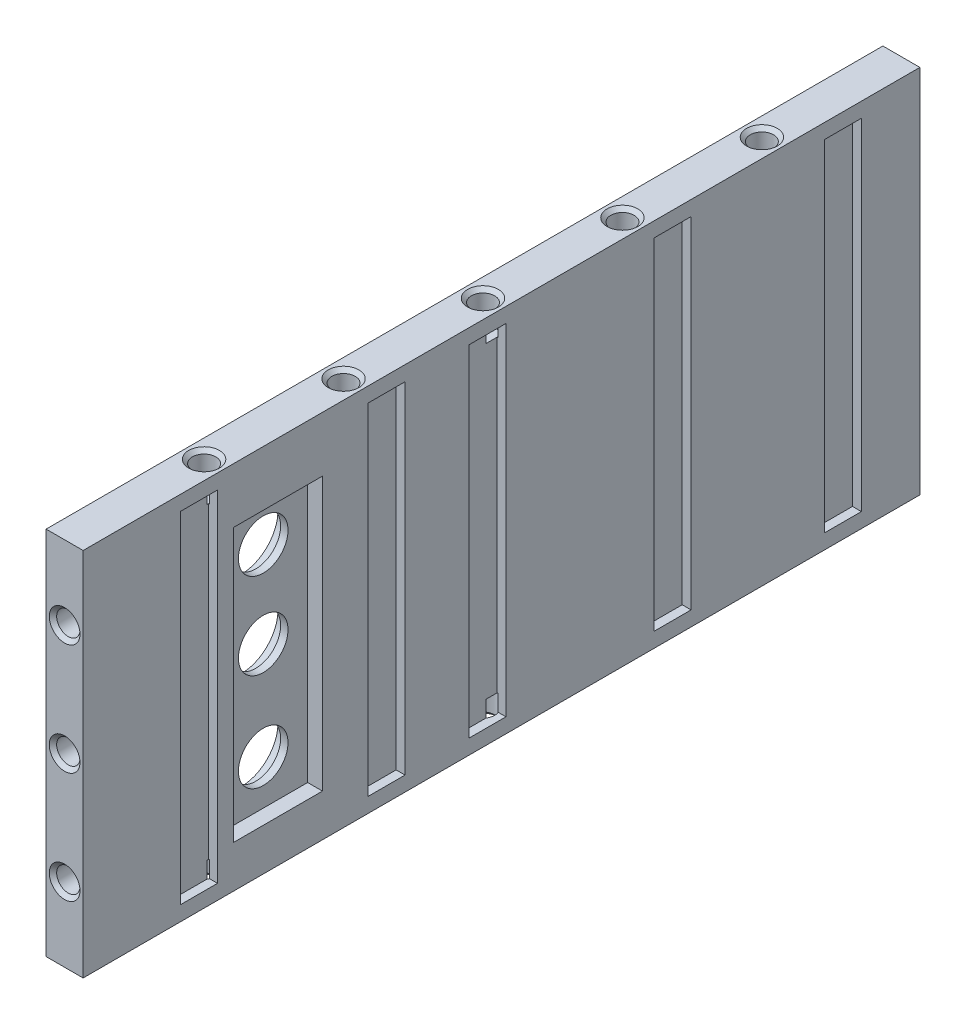
from build123d import *

# Parameters (mm, degrees)
SKETCH_1_W             = 113
SKETCH_1_H             = 50
EXTRUDE_1_DEPTH        = 5
SKETCH_2_R             = 1.575
CUT_EXTRUDE_610_DEPTH  = 4.2
SKETCH_3_R             = 1.575
CUT_EXTRUDE_919_DEPTH  = 4.2
SKETCH_4_W             = 5
SKETCH_4_H             = 46
CUT_EXTRUDE_1430_DEPTH = 1.2
SKETCH_5_R             = 3.35
SMA_DEPTH              = 116.840407458
SKETCH_6_R             = 5
SMA_2_DEPTH            = 2
SKETCH_7_W             = 12
SKETCH_7_H             = 36.84
SMA_3_DEPTH            = 2
CHAMFER_2760_SIZE      = 0.5


with BuildPart() as part:
    # Эскиз1 → Бобышка-Вытянуть1 (new body)
    with BuildSketch(Plane(origin=(0, 0, 0), x_dir=(0, 0, -1), z_dir=(1, 0, 0))):
        with Locations((-56.5, 0)):
            Rectangle(SKETCH_1_W, SKETCH_1_H)
    extrude(amount=EXTRUDE_1_DEPTH)

    # Эскиз2 → Cut-Extrude 610 (cut)
    with BuildSketch(Plane.XZ.offset(25)):
        with Locations(Location((2.5, 94.166666667, 0), (0, 0, 270))):
            Circle(SKETCH_2_R)
        with Locations(Location((2.5, 75.333333333, 0), (0, 0, 270))):
            Circle(SKETCH_2_R)
        with Locations(Location((2.5, 56.5, 0), (0, 0, 270))):
            Circle(SKETCH_2_R)
        with Locations(Location((2.5, 37.666666667, 0), (0, 0, 270))):
            Circle(SKETCH_2_R)
        with Locations(Location((2.5, 18.833333333, 0), (0, 0, 270))):
            Circle(SKETCH_2_R)
    cut_extrude_610 = extrude(amount=-CUT_EXTRUDE_610_DEPTH, mode=Mode.SUBTRACT)

    # Зеркальное отражение1: Cut-Extrude 610 across plane
    add(cut_extrude_610.mirror(Plane(origin=(0, 0, 0), x_dir=(0, 0, 1), z_dir=(0, -1, 0))), mode=Mode.SUBTRACT)

    # Эскиз3 → Cut-Extrude 919 (cut)
    with BuildSketch(Plane.XY.offset(113)):
        with Locations((2.5, 15)):
            Circle(SKETCH_3_R)
        with Locations((2.5, 0)):
            Circle(SKETCH_3_R)
        with Locations((2.5, -15)):
            Circle(SKETCH_3_R)
    cut_extrude_919 = extrude(amount=-CUT_EXTRUDE_919_DEPTH, mode=Mode.SUBTRACT)

    # Зеркальное отражение2: Cut-Extrude 919 across plane
    add(cut_extrude_919.mirror(Plane(origin=(0, 0, 56.5), x_dir=(1, 0, 0), z_dir=(0, 0, -1))), mode=Mode.SUBTRACT)

    # Эскиз4 → Cut-Extrude 1430 (cut)
    with BuildSketch(Plane(origin=(5, 0, 0), x_dir=(0, 0, -1), z_dir=(1, 0, 0))):
        with Locations((-10.4, 0)):
            Rectangle(SKETCH_4_W, SKETCH_4_H)
        with Locations((-33.4, 0)):
            Rectangle(SKETCH_4_W, SKETCH_4_H)
        with Locations((-58.4, 0)):
            Rectangle(SKETCH_4_W, SKETCH_4_H)
        with Locations((-72.03, 0)):
            Rectangle(SKETCH_4_W, SKETCH_4_H)
        with Locations((-97.35, 0)):
            Rectangle(SKETCH_4_W, SKETCH_4_H)
    extrude(amount=-CUT_EXTRUDE_1430_DEPTH, mode=Mode.SUBTRACT)

    # Эскиз5 → SMA раземы (cut, through all)
    with BuildSketch(Plane(origin=(5, 0, 0), x_dir=(0, 0, -1), z_dir=(1, 0, 0))):
        with Locations((-86.68, 11.54)):
            Circle(SKETCH_5_R)
        with Locations((-86.68, -0.09)):
            Circle(SKETCH_5_R)
        with Locations((-86.68, -13.3)):
            Circle(SKETCH_5_R)
    extrude(amount=-SMA_DEPTH, mode=Mode.SUBTRACT)

    # Эскиз6 → SMA раземы2 (cut)
    with BuildSketch(Plane.ZY):
        with Locations((86.68, 11.54)):
            Circle(SKETCH_6_R)
        with Locations((86.68, -0.09)):
            Circle(SKETCH_6_R)
        with Locations((86.68, -13.3)):
            Circle(SKETCH_6_R)
    extrude(amount=-SMA_2_DEPTH, mode=Mode.SUBTRACT)

    # Эскиз7 → SMA раземы3 (cut)
    with BuildSketch(Plane(origin=(5, 0, 0), x_dir=(0, 0, -1), z_dir=(1, 0, 0))):
        with Locations((-86.68, -0.88)):
            Rectangle(SKETCH_7_W, SKETCH_7_H)
    extrude(amount=-SMA_3_DEPTH, mode=Mode.SUBTRACT)

    # Chamfer 2760
    chamfer_2760_edges = [part.edges().sort_by_distance(p)[0] for p in [
        (2.5, -25, 95.741666667),
        (2.5, -25, 76.908333333),
        (2.5, -25, 58.075),
        (2.5, -25, 39.241666667),
        (2.5, -25, 20.408333333),
        (2.5, 25, 95.741666667),
        (2.5, 25, 76.908333333),
        (2.5, 25, 58.075),
        (2.5, 25, 39.241666667),
        (2.5, 25, 20.408333333),
        (0.925, 15, 113),
        (0.925, 0, 113),
        (0.925, -15, 113),
        (0.925, 15, 0),
        (0.925, 0, 0),
        (0.925, -15, 0),
    ]]
    chamfer(chamfer_2760_edges, length=CHAMFER_2760_SIZE)


solid = part.part
